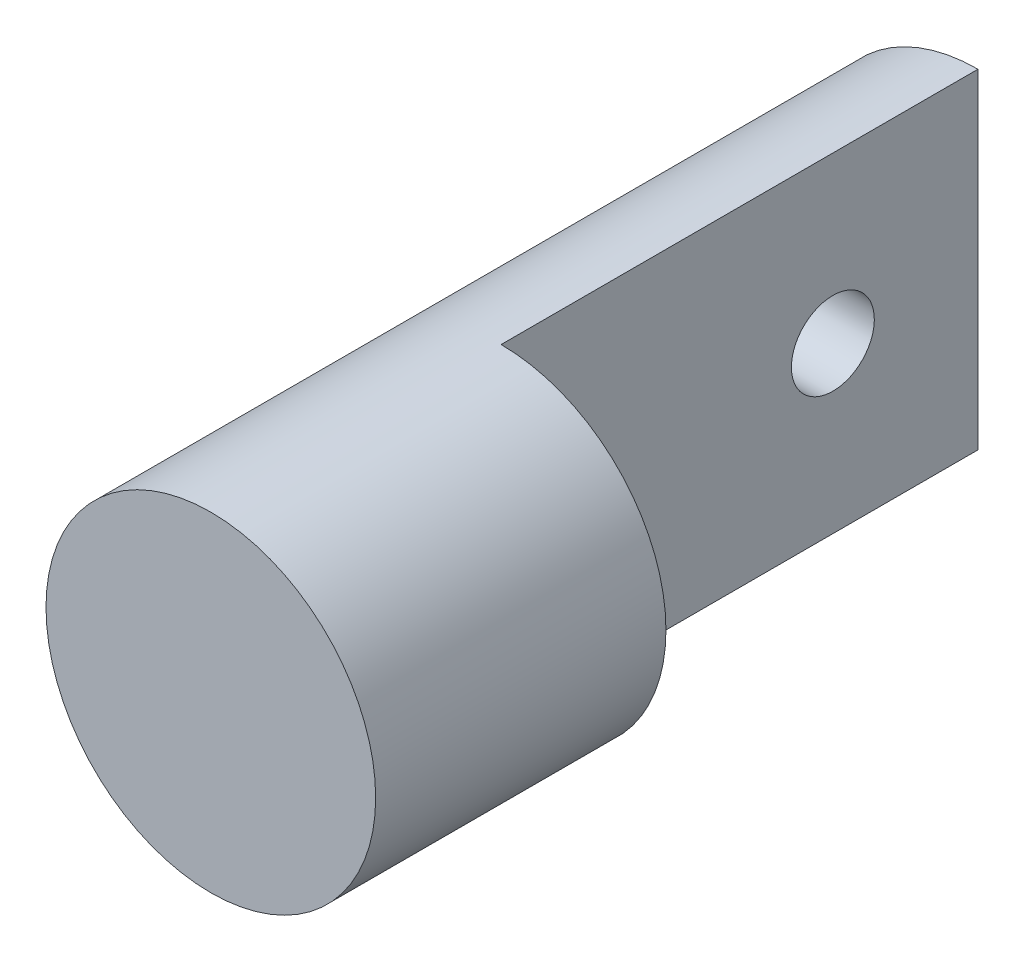
from build123d import *

# Parameters (mm, degrees)
SKETCH_1_R          = 7.95
EXTRUDE_1_DEPTH     = 30
SKETCH_2_R          = 7.95
EXTRUDE_2_DEPTH     = 10
SKETCH_3_W          = 7.95
SKETCH_3_H          = 15.9
CUT_EXTRUDE_1_DEPTH = 26
SKETCH_4_R          = 2
CUT_EXTRUDE_2_DEPTH = 42.550030084
M3X0_5_1_REACH      = 43.55
M3X0_5_1_BORE_R     = 1.25
CUT_EXTRUDE_3_DEPTH = 39.670466911


with BuildPart() as part:
    # ｽｹｯﾁ1 → ﾎﾞｽ - 押し出し1 (new body)
    with BuildSketch(Plane.XY):
        Circle(SKETCH_1_R)
    extrude(amount=EXTRUDE_1_DEPTH)

    # ｽｹｯﾁ2 → ﾎﾞｽ - 押し出し2 (add)
    with BuildSketch(Plane.XY.offset(30)):
        Circle(SKETCH_2_R)
    extrude(amount=EXTRUDE_2_DEPTH)

    # ｽｹｯﾁ3 → ｶｯﾄ - 押し出し1 (cut)
    with BuildSketch(Plane(origin=(0, 0, 0), x_dir=(-1, 0, 0), z_dir=(0, 0, -1))):
        with Locations((-3.975, 0)):
            Rectangle(SKETCH_3_W, SKETCH_3_H)
    extrude(amount=-CUT_EXTRUDE_1_DEPTH, mode=Mode.SUBTRACT)

    # ｽｹｯﾁ4 → ｶｯﾄ - 押し出し2 (cut, through all)
    with BuildSketch(Plane(origin=(0, 0, 0), x_dir=(0, 0, -1), z_dir=(1, 0, 0))):
        with Locations(Location((-10, 0, 0), (0, 0, 90))):
            Circle(SKETCH_4_R)
    extrude(amount=-CUT_EXTRUDE_2_DEPTH, mode=Mode.SUBTRACT)

    # M3x0.5 ねじ穴1 bore → M3x0.5 ねじ穴1 (cut, up to next)
    with BuildSketch(Plane(origin=(0, 0, 0), x_dir=(-1, 0, 0), z_dir=(0, 0, -1)), mode=Mode.PRIVATE) as m3x0_5_1_sk1:
        with Locations((3.95, 0)):
            Circle(M3X0_5_1_BORE_R)
    m3x0_5_1_tool1 = extrude(m3x0_5_1_sk1.sketch, amount=-M3X0_5_1_REACH, mode=Mode.PRIVATE) & part.part
    add(m3x0_5_1_tool1.solids().sort_by_distance((-3.95, 0, 0))[0], mode=Mode.SUBTRACT)

    # ｽｹｯﾁ7 → ｶｯﾄ - 押し出し3 (cut, through all)
    with BuildSketch(Plane(origin=(0, 0, 3), x_dir=(-1, 0, 0), z_dir=(0, 0, -1))):
        with BuildLine():
            Line((0, 7.95), (0, -7.95))
            ThreePointArc((0, -7.95), (7.95, 0), (0, 7.95))
        make_face()
    extrude(amount=CUT_EXTRUDE_3_DEPTH, mode=Mode.SUBTRACT)


solid = part.part
